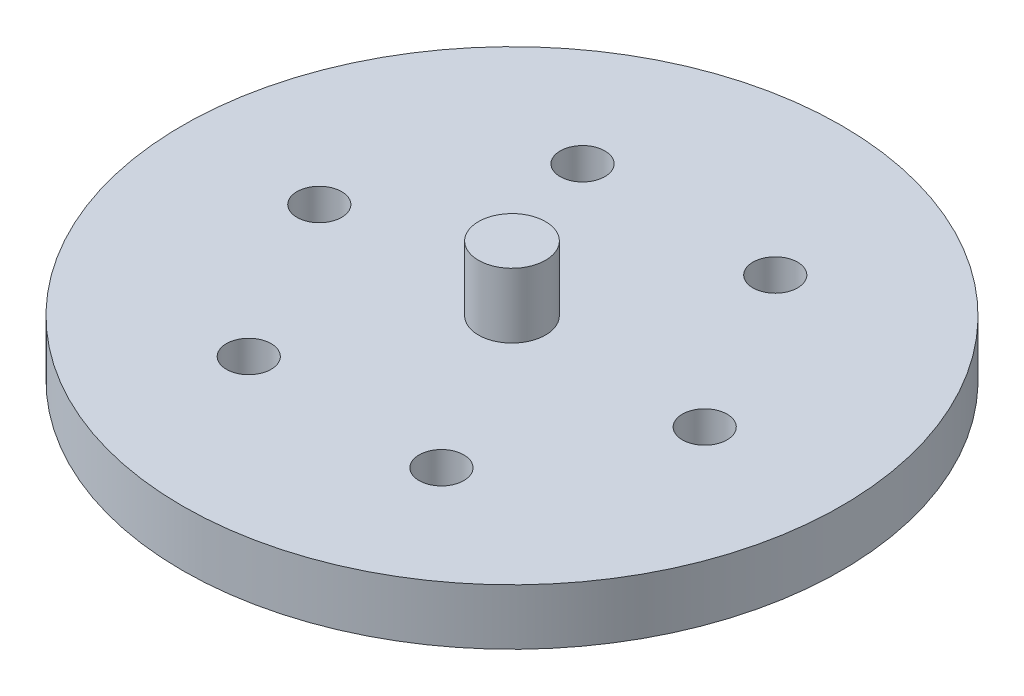
from build123d import *

# Parameters (mm, degrees)
SKETCH_1_R          = 29.5
EXTRUDE_1_DEPTH     = 5
SKETCH_2_R          = 3
EXTRUDE_2_DEPTH     = 5.8
SKETCH_3_R          = 2
CUT_EXTRUDE_1_DEPTH = 5
SKETCH_4_R          = 3
CUT_EXTRUDE_2_DEPTH = 1


with BuildPart() as part:
    # 草图1 → 凸台-拉伸1 (new body)
    with BuildSketch(Plane(origin=(0, 0, 0), x_dir=(1, 0, 0), z_dir=(0, 1, 0))):
        with Locations(Location((0, 0, 0), (0, 0, 270))):
            Circle(SKETCH_1_R)
    extrude(amount=EXTRUDE_1_DEPTH)

    # 草图2 → 凸台-拉伸2 (add)
    with BuildSketch(Plane(origin=(0, 5, 0), x_dir=(1, 0, 0), z_dir=(0, 1, 0))):
        with Locations(Location((0, 0, 0), (0, 0, 270))):
            Circle(SKETCH_2_R)
    extrude(amount=EXTRUDE_2_DEPTH)

    # 草图3 → 切除-拉伸1 (cut)
    with BuildSketch(Plane.XZ):
        with Locations(Location((17.25, 0, 0), (0, 0, 270))):
            Circle(SKETCH_3_R)
        with Locations(Location((8.625, -14.938938215, 0), (0, 0, 270))):
            Circle(SKETCH_3_R)
        with Locations(Location((-8.625, -14.938938215, 0), (0, 0, 270))):
            Circle(SKETCH_3_R)
        with Locations(Location((-17.25, 0, 0), (0, 0, 270))):
            Circle(SKETCH_3_R)
        with Locations(Location((-8.625, 14.938938215, 0), (0, 0, 270))):
            Circle(SKETCH_3_R)
        with Locations(Location((8.625, 14.938938215, 0), (0, 0, 270))):
            Circle(SKETCH_3_R)
    extrude(amount=-CUT_EXTRUDE_1_DEPTH, mode=Mode.SUBTRACT)

    # 草图4 → 切除-拉伸2 (cut)
    with BuildSketch(Plane.XZ):
        with Locations(Location((0, 0, 0), (0, 0, 90))):
            Circle(SKETCH_4_R)
    extrude(amount=-CUT_EXTRUDE_2_DEPTH, mode=Mode.SUBTRACT)


solid = part.part
